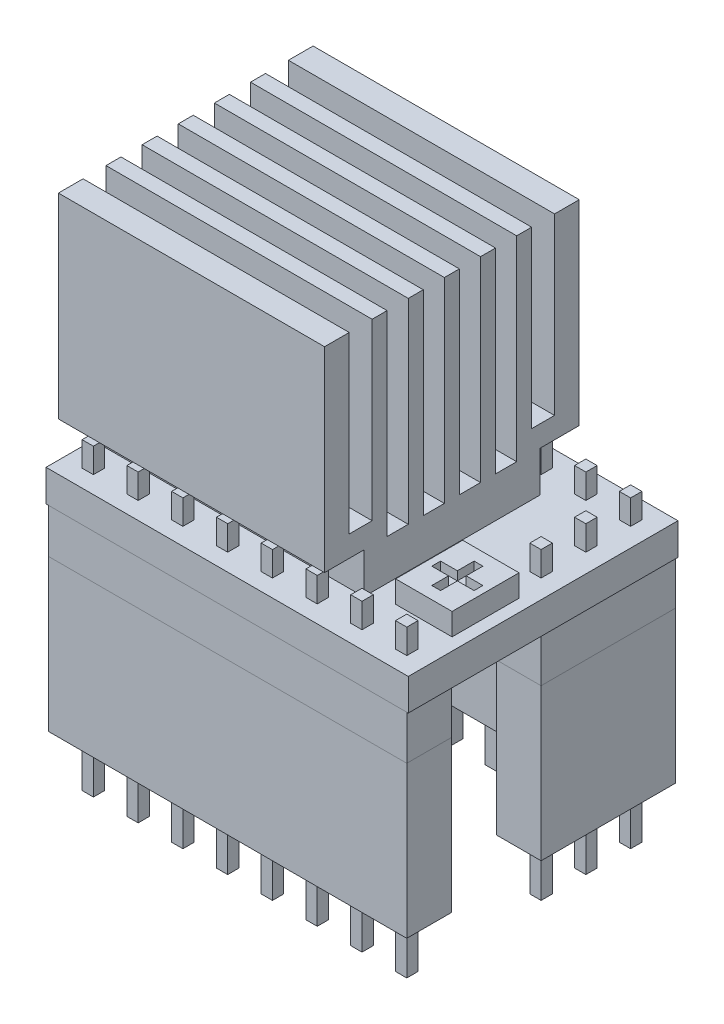
from build123d import *

# Parameters (mm, degrees)
SKETCH1_W                = 20.55
SKETCH1_H                = 15.3
BOSS_EXTRUDE1_DEPTH      = 1.8
BOSS_EXTRUDE2_DEPTH      = 1.4
BOSS_EXTRUDE2_DEPTH_BACK = 10.2
SKETCH2_W                = 0.64
SKETCH2_H                = 0.64
SKETCH3_W                = 20.32
SKETCH3_H                = 2.54
SKETCH3_W_2              = 2.54
SKETCH3_H_2              = 5.08
BOSS_EXTRUDE3_DEPTH      = 2.54
SKETCH4_W                = 3.2
SKETCH4_H                = 3.8
BOSS_EXTRUDE4_DEPTH      = 1.25
CUT_EXTRUDE1_DEPTH       = 0.5
SKETCH6_W                = 5
SKETCH6_H                = 9.8
BOSS_EXTRUDE5_DEPTH      = 1.2
BOSS_EXTRUDE6_START      = -10
BOSS_EXTRUDE6_DEPTH      = 15.1
SKETCH8_W                = 20.32
SKETCH8_H                = 2.54
BOSS_EXTRUDE7_DEPTH      = 8.6
BOSS_EXTRUDE7_2_DEPTH    = 8.6
BOSS_EXTRUDE8_START      = -12.94
SKETCH2_2_W              = 0.64
SKETCH2_2_H              = 0.64
BOSS_EXTRUDE8_DEPTH      = 2.9


with BuildPart() as part:
    # Sketch1 → Boss-Extrude1 (new body)
    with BuildSketch(Plane(origin=(0, 0, 0), x_dir=(1, 0, 0), z_dir=(0, 1, 0))):
        Rectangle(SKETCH1_W, SKETCH1_H)
    extrude(amount=BOSS_EXTRUDE1_DEPTH)

    # Sketch2 → Boss-Extrude2 (add, two sides: drawn at the far end of the back side and taken through both)
    with BuildSketch(Plane(origin=(0, 1.8, 0), x_dir=(1, 0, 0), z_dir=(0, 1, 0)).offset(-BOSS_EXTRUDE2_DEPTH_BACK)):
        with Locations((-6.35, 6.35)):
            Rectangle(SKETCH2_W, SKETCH2_H)
        with Locations((-3.81, 6.35)):
            Rectangle(SKETCH2_W, SKETCH2_H)
        with Locations((-8.89, 6.35)):
            Rectangle(SKETCH2_W, SKETCH2_H)
        with Locations((-1.27, 6.35)):
            Rectangle(SKETCH2_W, SKETCH2_H)
        with Locations((1.27, 6.35)):
            Rectangle(SKETCH2_W, SKETCH2_H)
        with Locations((3.81, 6.35)):
            Rectangle(SKETCH2_W, SKETCH2_H)
        with Locations((6.35, 6.35)):
            Rectangle(SKETCH2_W, SKETCH2_H)
        with Locations((8.89, 6.35)):
            Rectangle(SKETCH2_W, SKETCH2_H)
        with Locations((-6.35, -6.35)):
            Rectangle(SKETCH2_W, SKETCH2_H)
        with Locations((-3.81, -6.35)):
            Rectangle(SKETCH2_W, SKETCH2_H)
        with Locations((-1.27, -6.35)):
            Rectangle(SKETCH2_W, SKETCH2_H)
        with Locations((1.27, -6.35)):
            Rectangle(SKETCH2_W, SKETCH2_H)
        with Locations((3.81, -6.35)):
            Rectangle(SKETCH2_W, SKETCH2_H)
        with Locations((6.35, -6.35)):
            Rectangle(SKETCH2_W, SKETCH2_H)
        with Locations((8.89, -6.35)):
            Rectangle(SKETCH2_W, SKETCH2_H)
        with Locations((-8.89, -6.35)):
            Rectangle(SKETCH2_W, SKETCH2_H)
        with Locations((8.89, 3.81)):
            Rectangle(SKETCH2_W, SKETCH2_H)
        with Locations((8.89, 1.27)):
            Rectangle(SKETCH2_W, SKETCH2_H)
    extrude(amount=BOSS_EXTRUDE2_DEPTH + BOSS_EXTRUDE2_DEPTH_BACK)


with BuildPart() as body_2:
    # Sketch3 → Boss-Extrude3 (new body)
    with BuildSketch(Plane.XZ):
        with Locations((0, 6.35)):
            Rectangle(SKETCH3_W, SKETCH3_H)
        Polygon((7.62, -5.08), (-10.16, -5.08), (-10.16, -7.62), (10.16, -7.62), (10.16, -5.08), align=None)
        with Locations((8.89, -2.54)):
            Rectangle(SKETCH3_W_2, SKETCH3_H_2)
    extrude(amount=BOSS_EXTRUDE3_DEPTH)


with BuildPart() as body_3:
    # Sketch4 → Boss-Extrude4 (new body)
    with BuildSketch(Plane(origin=(0, 1.8, 0), x_dir=(1, 0, 0), z_dir=(0, 1, 0))):
        with Locations((7.975, -2.565288135)):
            Rectangle(SKETCH4_W, SKETCH4_H)
    extrude(amount=BOSS_EXTRUDE4_DEPTH)

    # Sketch5 → Cut-Extrude1 (cut)
    with BuildSketch(Plane(origin=(0, 3.05, 0), x_dir=(1, 0, 0), z_dir=(0, 1, 0))):
        Polygon((6.775, -2.815288135), (6.775, -2.315288135), (7.725, -2.315288135), (7.725, -1.365288135), (8.225, -1.365288135), (8.225, -2.315288135), (9.175, -2.315288135), (9.175, -2.815288135), (8.225, -2.815288135), (8.225, -3.765288135), (7.725, -3.765288135), (7.725, -2.815288135), align=None)
    extrude(amount=-CUT_EXTRUDE1_DEPTH, mode=Mode.SUBTRACT)


with BuildPart() as body_4:
    # Sketch6 → Boss-Extrude5 (new body)
    with BuildSketch(Plane.XZ):
        Rectangle(SKETCH6_W, SKETCH6_H)
    extrude(amount=BOSS_EXTRUDE5_DEPTH)


with BuildPart() as body_5:
    # Sketch7 → Boss-Extrude6 (new body)
    with BuildSketch(Plane(origin=(0, 0, 0), x_dir=(0, 0, -1), z_dir=(1, 0, 0)).offset(BOSS_EXTRUDE6_START)):
        Polygon((-5, 1.8), (5, 1.8), (5, 4.1), (7.225, 4.1), (7.225, 15.2), (5.825, 15.2), (5.825, 5.3), (4.525, 5.3), (4.525, 15.2), (3.675, 15.2), (3.675, 4.1), (2.475, 4.1), (2.475, 15.2), (1.625, 15.2), (1.625, 4.1), (0.425, 4.1), (0.425, 15.2), (-0.425, 15.2), (-0.425, 4.1), (-1.625, 4.1), (-1.625, 15.2), (-2.475, 15.2), (-2.475, 4.1), (-3.675, 4.1), (-3.675, 15.2), (-4.525, 15.2), (-4.525, 5.3), (-5.825, 5.3), (-5.825, 15.2), (-7.225, 15.2), (-7.225, 4.1), (-5, 4.1), align=None)
    extrude(amount=BOSS_EXTRUDE6_DEPTH)


with BuildPart() as body_6:
    # Sketch8 → Boss-Extrude7 (new body)
    with BuildSketch(Plane.XZ.offset(2.54)):
        with Locations((0, 6.35)):
            Rectangle(SKETCH8_W, SKETCH8_H)
    extrude(amount=BOSS_EXTRUDE7_DEPTH)



with BuildPart() as body_7:
    # Sketch8 → Boss-Extrude7 2 (new body)
    with BuildSketch(Plane.XZ.offset(2.54)):
        Polygon((7.62, 0), (7.62, -5.08), (-10.16, -5.08), (-10.16, -7.62), (10.16, -7.62), (10.16, 0), align=None)
    extrude(amount=BOSS_EXTRUDE7_2_DEPTH)


with BuildPart() as body_6_1:
    add(body_6.part)

    add(body_7.part)  # Boss-Extrude8 merges body 7
    # Sketch2<2> → Boss-Extrude8 (add)
    with BuildSketch(Plane(origin=(0, 1.8, 0), x_dir=(1, 0, 0), z_dir=(0, 1, 0)).offset(BOSS_EXTRUDE8_START)):
        with Locations((-6.35, 6.35)):
            Rectangle(SKETCH2_2_W, SKETCH2_2_H)
        with Locations((-3.81, 6.35)):
            Rectangle(SKETCH2_2_W, SKETCH2_2_H)
        with Locations((-8.89, 6.35)):
            Rectangle(SKETCH2_2_W, SKETCH2_2_H)
        with Locations((-1.27, 6.35)):
            Rectangle(SKETCH2_2_W, SKETCH2_2_H)
        with Locations((1.27, 6.35)):
            Rectangle(SKETCH2_2_W, SKETCH2_2_H)
        with Locations((3.81, 6.35)):
            Rectangle(SKETCH2_2_W, SKETCH2_2_H)
        with Locations((6.35, 6.35)):
            Rectangle(SKETCH2_2_W, SKETCH2_2_H)
        with Locations((8.89, 6.35)):
            Rectangle(SKETCH2_2_W, SKETCH2_2_H)
        with Locations((-6.35, -6.35)):
            Rectangle(SKETCH2_2_W, SKETCH2_2_H)
        with Locations((-3.81, -6.35)):
            Rectangle(SKETCH2_2_W, SKETCH2_2_H)
        with Locations((-1.27, -6.35)):
            Rectangle(SKETCH2_2_W, SKETCH2_2_H)
        with Locations((1.27, -6.35)):
            Rectangle(SKETCH2_2_W, SKETCH2_2_H)
        with Locations((3.81, -6.35)):
            Rectangle(SKETCH2_2_W, SKETCH2_2_H)
        with Locations((6.35, -6.35)):
            Rectangle(SKETCH2_2_W, SKETCH2_2_H)
        with Locations((8.89, -6.35)):
            Rectangle(SKETCH2_2_W, SKETCH2_2_H)
        with Locations((-8.89, -6.35)):
            Rectangle(SKETCH2_2_W, SKETCH2_2_H)
        with Locations((8.89, 3.81)):
            Rectangle(SKETCH2_2_W, SKETCH2_2_H)
        with Locations((8.89, 1.27)):
            Rectangle(SKETCH2_2_W, SKETCH2_2_H)
    extrude(amount=-BOSS_EXTRUDE8_DEPTH)


solid = Compound([part.part, body_2.part, body_3.part, body_4.part, body_5.part, body_6_1.part])
